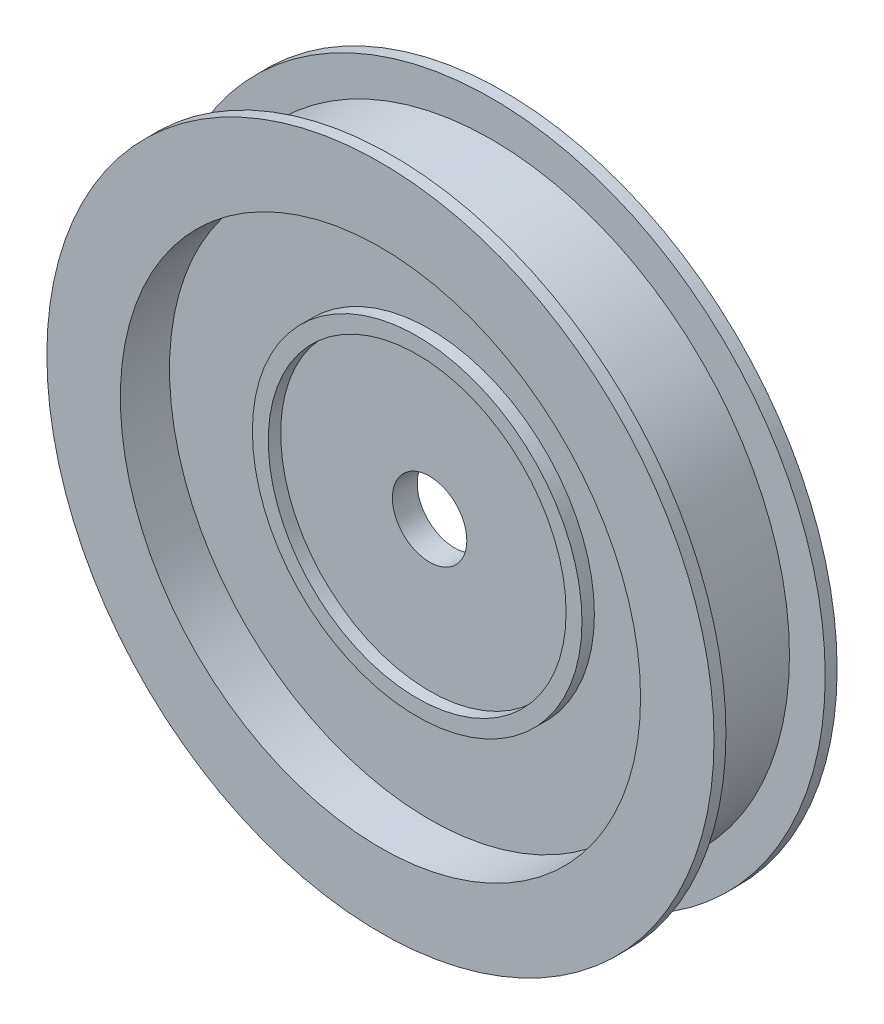
from build123d import *

# Parameters (mm, degrees)
SKETCH1_R           = 19.05
BOSS_EXTRUDE1_DEPTH = 0.79375
SKETCH3_R           = 19.05
SKETCH3_R_2         = 16.637
BOSS_EXTRUDE2_DEPTH = 3.175
SKETCH4_R           = 10.541
SKETCH4_R_2         = 9.525
BOSS_EXTRUDE3_DEPTH = 1.5875
SKETCH6_R           = 2.38125
CUT_EXTRUDE4_DEPTH  = 28.231525417
SKETCH7_R           = 21.336
SKETCH7_R_2         = 16.637
BOSS_EXTRUDE5_DEPTH = 0.762


with BuildPart() as part:
    # Sketch1 → Boss-Extrude1 (new, symmetric)
    with BuildSketch(Plane.XY):
        Circle(SKETCH1_R)
    extrude(amount=BOSS_EXTRUDE1_DEPTH, both=True)

    # Sketch3 → Boss-Extrude2 (add, symmetric)
    with BuildSketch(Plane.XY):
        Circle(SKETCH3_R)
        Circle(SKETCH3_R_2, mode=Mode.SUBTRACT)
    extrude(amount=BOSS_EXTRUDE2_DEPTH, both=True)

    # Sketch4 → Boss-Extrude3 (add, symmetric)
    with BuildSketch(Plane.XY):
        Circle(SKETCH4_R)
        Circle(SKETCH4_R_2, mode=Mode.SUBTRACT)
    extrude(amount=BOSS_EXTRUDE3_DEPTH, both=True)

    # Sketch6 → Cut-Extrude4 (cut, through all)
    with BuildSketch(Plane.XY.offset(0.79375)):
        Circle(SKETCH6_R)
    extrude(amount=-CUT_EXTRUDE4_DEPTH, mode=Mode.SUBTRACT)

    # Sketch7 → Boss-Extrude5 (add)
    with BuildSketch(Plane.XY.offset(3.175)):
        with Locations(Location((0, 0, 0), (0, 0, 180))):
            Circle(SKETCH7_R)
        Circle(SKETCH7_R_2, mode=Mode.SUBTRACT)
    boss_extrude5 = extrude(amount=BOSS_EXTRUDE5_DEPTH)

    # Mirror3: Boss-Extrude5 across plane
    add(boss_extrude5.mirror(Plane.XY))


solid = part.part
